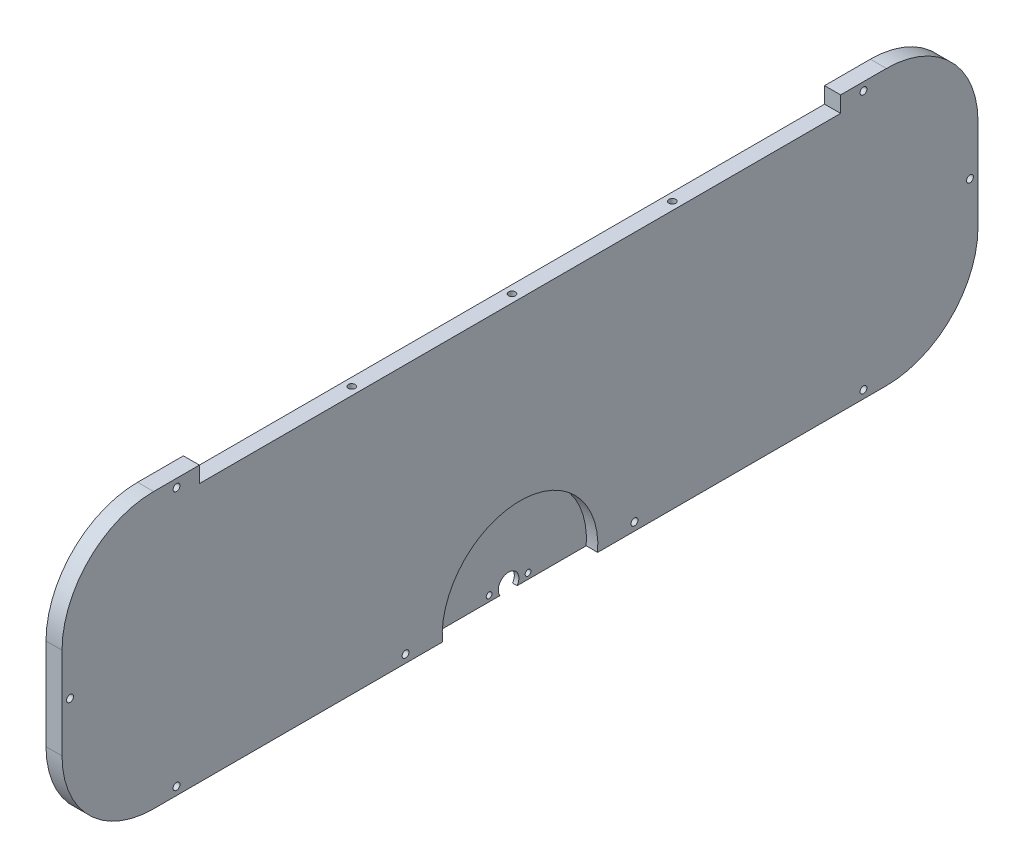
from build123d import *

# Parameters (mm, degrees)
BOSS_EXTRUDE1_DEPTH     = 7
CUT_EXTRUDE1_DEPTH      = 234.343095034
CUT_EXTRUDE1_DEPTH_BACK = 234.343095034
SKETCH2_R               = 1.5
SKETCH2_W               = 280
SKETCH2_H               = 7
CUT_EXTRUDE2_DEPTH      = 230.821669997
CUT_EXTRUDE2_DEPTH_BACK = 10
CUT_EXTRUDE2_START      = 3
SKETCH3_R               = 1.5
SKETCH4_R               = 1.25
CUT_EXTRUDE3_DEPTH      = 10
CUT_EXTRUDE4_DEPTH      = 4
SKETCH6_R               = 4.5
CUT_EXTRUDE5_DEPTH      = 234.272372989
SKETCH7_R               = 34
CUT_EXTRUDE6_DEPTH      = 5


with BuildPart() as part:
    # Sketch1 → Boss-Extrude1 (new body)
    with BuildSketch(Plane(origin=(0, 0, 0), x_dir=(0, 0, -1), z_dir=(1, 0, 0))):
        with BuildLine():
            Line((160, 0), (-160, 0))
            ThreePointArc((-160, 0), (-188.284271247, 11.715728753), (-200, 40))
            Line((-200, 40), (-200, 80))
            ThreePointArc((-200, 80), (-188.284271247, 108.284271247), (-160, 120))
            Line((-160, 120), (160, 120))
            ThreePointArc((160, 120), (188.284271247, 108.284271247), (200, 80))
            Line((200, 80), (200, 40))
            ThreePointArc((200, 40), (188.284271247, 11.715728753), (160, 0))
        make_face()
    extrude(amount=BOSS_EXTRUDE1_DEPTH)

    # Sketch2 → Cut-Extrude1 (cut, two sides: drawn at the far end of the back side and taken through both)
    with BuildSketch(Plane(origin=(7, 0, 0), x_dir=(0, 0, -1), z_dir=(1, 0, 0)).offset(-CUT_EXTRUDE1_DEPTH_BACK)):
        with Locations((-150, 116.5)):
            Circle(SKETCH2_R)
        with Locations((-196.5, 60)):
            Circle(SKETCH2_R)
        with Locations((-50, 3.5)):
            Circle(SKETCH2_R)
        with Locations((-150, 3.5)):
            Circle(SKETCH2_R)
        with Locations(Location((50, 3.5, 0), (0, 0, 180))):
            Circle(SKETCH2_R)
        with Locations(Location((150, 3.5, 0), (0, 0, 180))):
            Circle(SKETCH2_R)
        with Locations(Location((196.5, 60, 0), (0, 0, 180))):
            Circle(SKETCH2_R)
        with Locations(Location((150, 116.5, 0), (0, 0, 180))):
            Circle(SKETCH2_R)
        with Locations((0, 116.5)):
            Rectangle(SKETCH2_W, SKETCH2_H)
    extrude(amount=CUT_EXTRUDE1_DEPTH + CUT_EXTRUDE1_DEPTH_BACK, mode=Mode.SUBTRACT)

    # Sketch3 → Cut-Extrude2 (cut, two sides: drawn at the far end of the back side and taken through both)
    with BuildSketch(Plane(origin=(0, 113, 0), x_dir=(1, 0, 0), z_dir=(0, 1, 0)).offset(CUT_EXTRUDE2_START - CUT_EXTRUDE2_DEPTH_BACK)):
        with Locations(Location((3.5, 70, 0), (0, 0, 90))):
            Circle(SKETCH3_R)
        with Locations(Location((3.5, 0, 0), (0, 0, 90))):
            Circle(SKETCH3_R)
        with Locations(Location((3.5, -70, 0), (0, 0, 90))):
            Circle(SKETCH3_R)
    extrude(amount=CUT_EXTRUDE2_DEPTH + CUT_EXTRUDE2_DEPTH_BACK, mode=Mode.SUBTRACT)

    # Sketch4 → Cut-Extrude3 (cut)
    with BuildSketch(Plane(origin=(7, 0, 0), x_dir=(0, 0, -1), z_dir=(1, 0, 0))):
        with Locations((-8.5, 2.5)):
            Circle(SKETCH4_R)
        with Locations((8.5, 2.5)):
            Circle(SKETCH4_R)
    extrude(amount=-CUT_EXTRUDE3_DEPTH, mode=Mode.SUBTRACT)

    # Sketch5 → Cut-Extrude4 (cut)
    with BuildSketch(Plane(origin=(7, 0, 0), x_dir=(0, 0, -1), z_dir=(1, 0, 0))):
        with BuildLine():
            Line((14, -15), (-14, -15))
            Line((-14, -15), (-14, 5))
            ThreePointArc((-14, 5), (0, 19), (14, 5))
            Line((14, 5), (14, -15))
        make_face()
    extrude(amount=-CUT_EXTRUDE4_DEPTH, mode=Mode.SUBTRACT)

    # Sketch6 → Cut-Extrude5 (cut, through all)
    with BuildSketch(Plane(origin=(3, 0, 0), x_dir=(0, 0, -1), z_dir=(1, 0, 0))):
        with Locations((0, 2.5)):
            Circle(SKETCH6_R)
    extrude(amount=-CUT_EXTRUDE5_DEPTH, mode=Mode.SUBTRACT)

    # Sketch7 → Cut-Extrude6 (cut)
    with BuildSketch(Plane(origin=(7, 0, 0), x_dir=(0, 0, -1), z_dir=(1, 0, 0))):
        with Locations((0, 2.5)):
            Circle(SKETCH7_R)
    extrude(amount=-CUT_EXTRUDE6_DEPTH, mode=Mode.SUBTRACT)


solid = part.part
